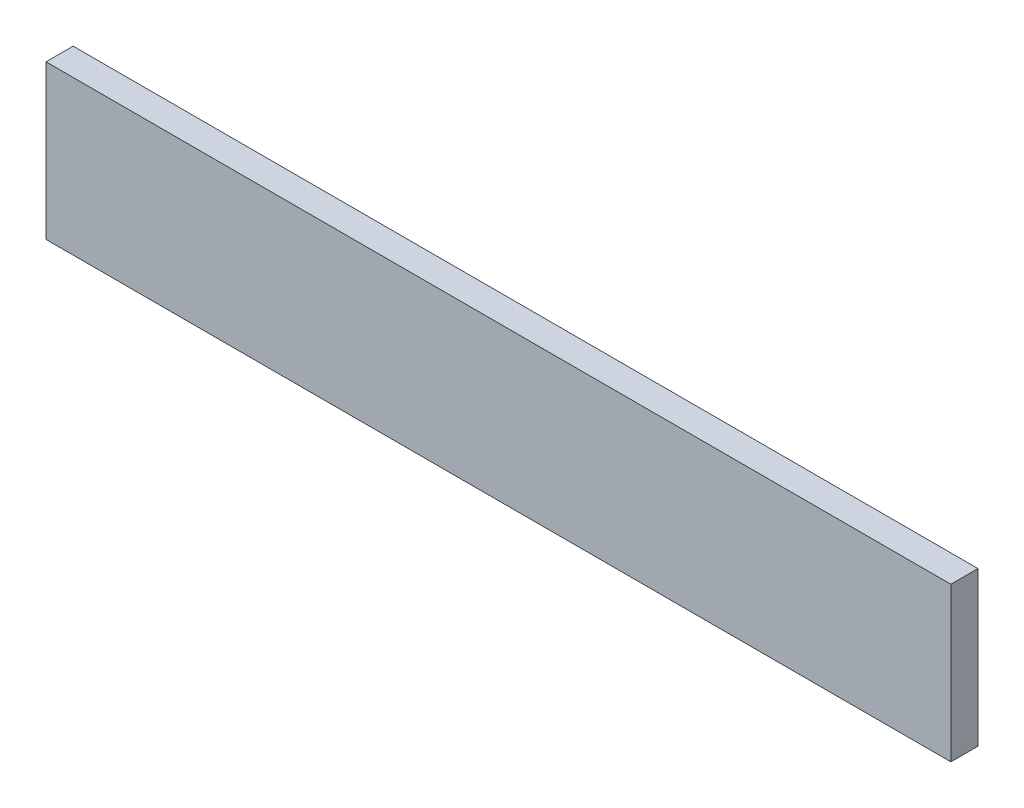
from build123d import *

# Parameters (mm, degrees)
SKETCH1_W           = 100
SKETCH1_H           = 17
BOSS_EXTRUDE1_DEPTH = 3


with BuildPart() as part:
    # Sketch1 → Boss-Extrude1 (new body)
    with BuildSketch(Plane.XY):
        Rectangle(SKETCH1_W, SKETCH1_H)
    extrude(amount=BOSS_EXTRUDE1_DEPTH)


solid = part.part
